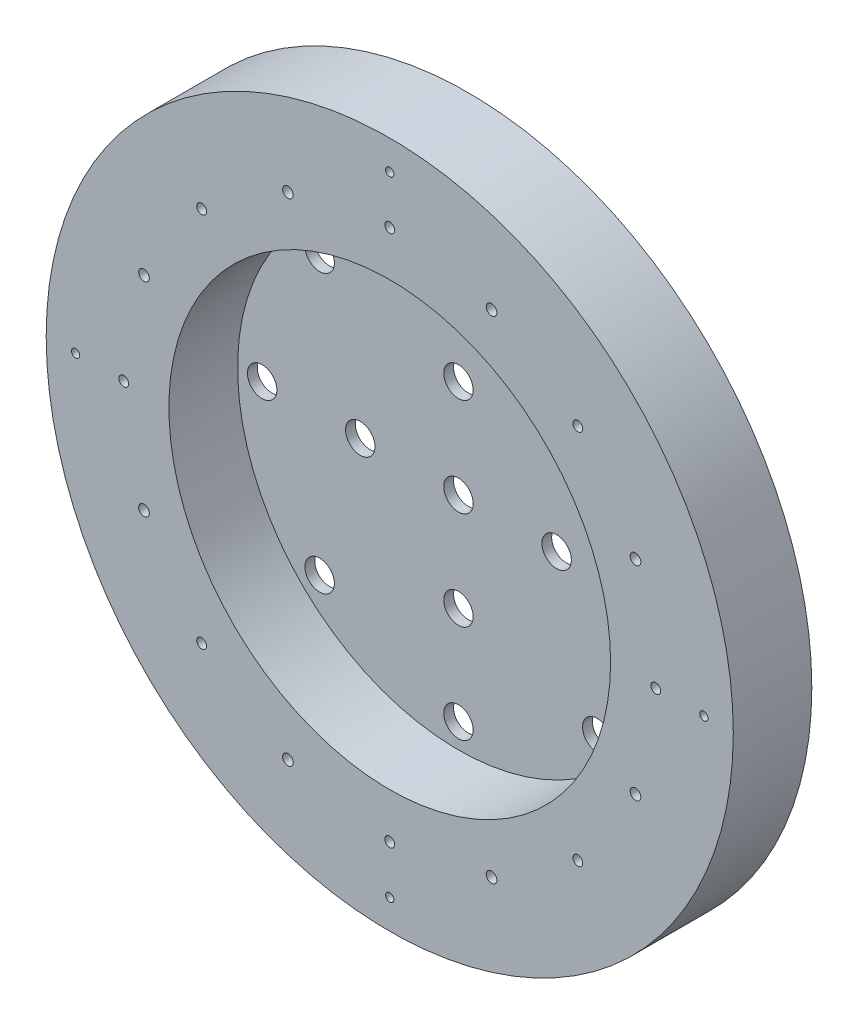
from build123d import *

# Parameters (mm, degrees)
SKETCH_1_R             = 175
EXTRUDE_1_DEPTH        = 40
SKETCH_2_R             = 112.5
CUT_EXTRUDE_1_DEPTH    = 35
HOLE_WIZARD_M12_1_D    = 15
M6X1_0_1_D             = 5
HOLE_WIZARD_1_4_28_1_D = 5.4102
M5X0_8_1_D             = 4.2


with BuildPart() as part:
    # ｽｹｯﾁ1 → ﾎﾞｽ - 押し出し1 (new body)
    with BuildSketch(Plane.XY):
        Circle(SKETCH_1_R)
    extrude(amount=EXTRUDE_1_DEPTH)

    # ｽｹｯﾁ2 → ｶｯﾄ - 押し出し1 (cut)
    with BuildSketch(Plane.XY.offset(40)):
        Circle(SKETCH_2_R)
    extrude(amount=-CUT_EXTRUDE_1_DEPTH, mode=Mode.SUBTRACT)

    # M12 すきま穴1 (through all)
    with Locations(Plane.XY.offset(5)):
        with Locations((0, 100), (0, 50), (70.710678119, 70.710678119), (100, 0), (70.710678119, -70.710678119), (0, -100), (-70.710678119, -70.710678119), (-100, 0), (-70.710678119, 70.710678119), (0, 0), (50, 0), (0, -50), (-50, 0)):
            Hole(HOLE_WIZARD_M12_1_D / 2)

    # M6x1.0 ねじ穴1 (through all)
    with Locations(Plane.XY.offset(40)):
        with Locations((0, 135.5), (95.812968851, 95.812968851), (135.5, 0), (95.812968851, -95.812968851), (0, -135.5), (-95.812968851, -95.812968851), (-135.5, 0), (-95.812968851, 95.812968851), (0, 0)):
            Hole(M6X1_0_1_D / 2)

    # 1/4-28 ねじ穴1 (through all)
    with Locations(Plane.XY.offset(40)):
        with Locations((51.853605085, 125.185676655), (125.185676655, 51.853605085), (125.185676655, -51.853605085), (51.853605085, -125.185676655), (-51.853605085, -125.185676655), (-125.185676655, -51.853605085), (-125.185676655, 51.853605085), (-51.853605085, 125.185676655), (0, 0)):
            Hole(HOLE_WIZARD_1_4_28_1_D / 2)

    # M5x0.8 ねじ穴1 (through all)
    with Locations(Plane.XY.offset(40)):
        with Locations((0, 160), (160, 0), (0, -160), (-160, 0), (0, 0)):
            Hole(M5X0_8_1_D / 2)


solid = part.part
